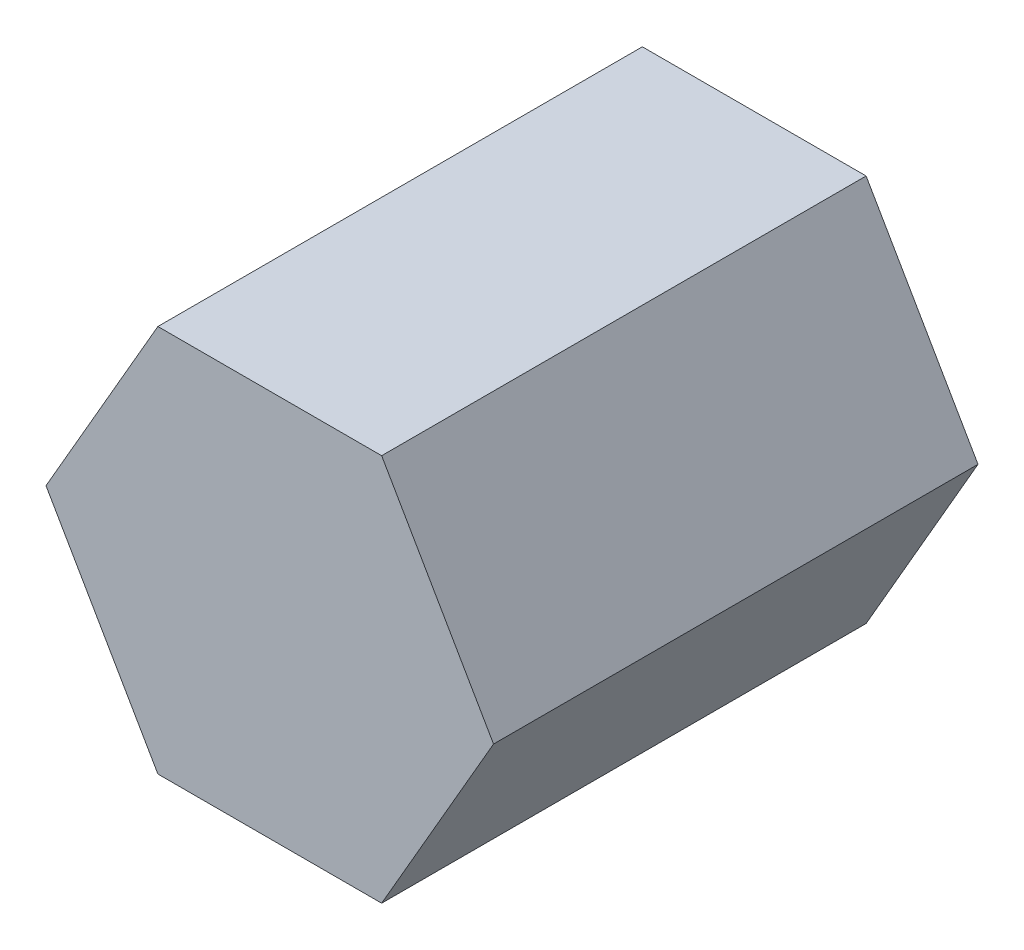
from build123d import *

# Parameters (mm, degrees)
BOSS_EXTRUDE1_DEPTH = 10
CUT_EXTRUDE1_DEPTH  = 9


with BuildPart() as part:
    # Sketch1 → Boss-Extrude1 (new body)
    with BuildSketch(Plane.XY):
        Polygon((4.618802154, 0), (2.309401077, 4), (-2.309401077, 4), (-4.618802154, 0), (-2.309401077, -4), (2.309401077, -4), align=None)
    extrude(amount=BOSS_EXTRUDE1_DEPTH)

    # Sketch2 → Cut-Extrude1 (cut)
    with BuildSketch(Plane(origin=(0, 0, 0), x_dir=(-1, 0, 0), z_dir=(0, 0, -1))):
        with BuildLine():
            Line((-1.11, 1.045717457), (1.11, 1.045717457))
            ThreePointArc((1.11, 1.045717457), (0, -1.525), (-1.11, 1.045717457))
        make_face()
    extrude(amount=-CUT_EXTRUDE1_DEPTH, mode=Mode.SUBTRACT)


solid = part.part
